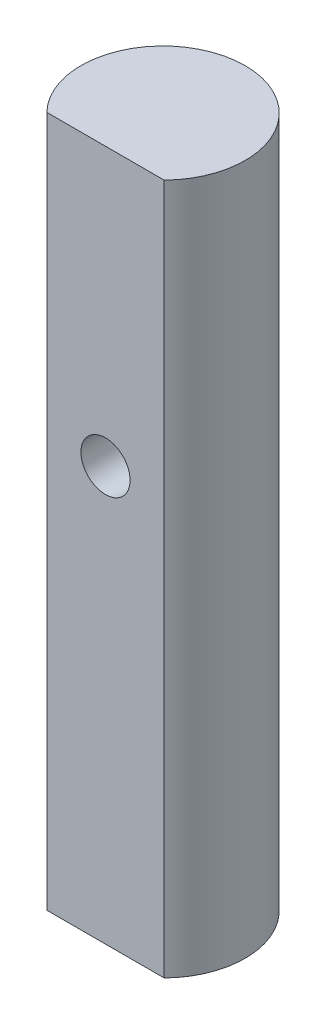
from build123d import *

# Parameters (mm, degrees)
SKETCH1_R              = 6.35
BOSS_EXTRUDE1_DEPTH    = 53.401902472
CUT_EXTRUDE1_DEPTH     = 55.15171454
F_10_24_TAPPED_HOLE1_D = 3.7973


with BuildPart() as part:
    # Sketch1 → Boss-Extrude1 (new body)
    with BuildSketch(Plane(origin=(0, 0, 0), x_dir=(1, 0, 0), z_dir=(0, 1, 0))):
        with Locations(Location((0, 0, 0), (0, 0, 90))):
            Circle(SKETCH1_R)
    extrude(amount=BOSS_EXTRUDE1_DEPTH)

    # Sketch2 → Cut-Extrude1 (cut, through all)
    with BuildSketch(Plane(origin=(0, 53.401902472, 0), x_dir=(1, 0, 0), z_dir=(0, 1, 0))):
        Polygon((0, -4.445), (-5.65519603, -4.445), (-5.65519603, -6.850474894), (5.907942222, -6.850474894), (5.907942222, -4.445), align=None)
    extrude(amount=-CUT_EXTRUDE1_DEPTH, mode=Mode.SUBTRACT)

    # #10-24 Tapped Hole1 (through all)
    with Locations(Plane.XY.offset(4.445)):
        with Locations((0, 31.988125)):
            Hole(F_10_24_TAPPED_HOLE1_D / 2)


solid = part.part
